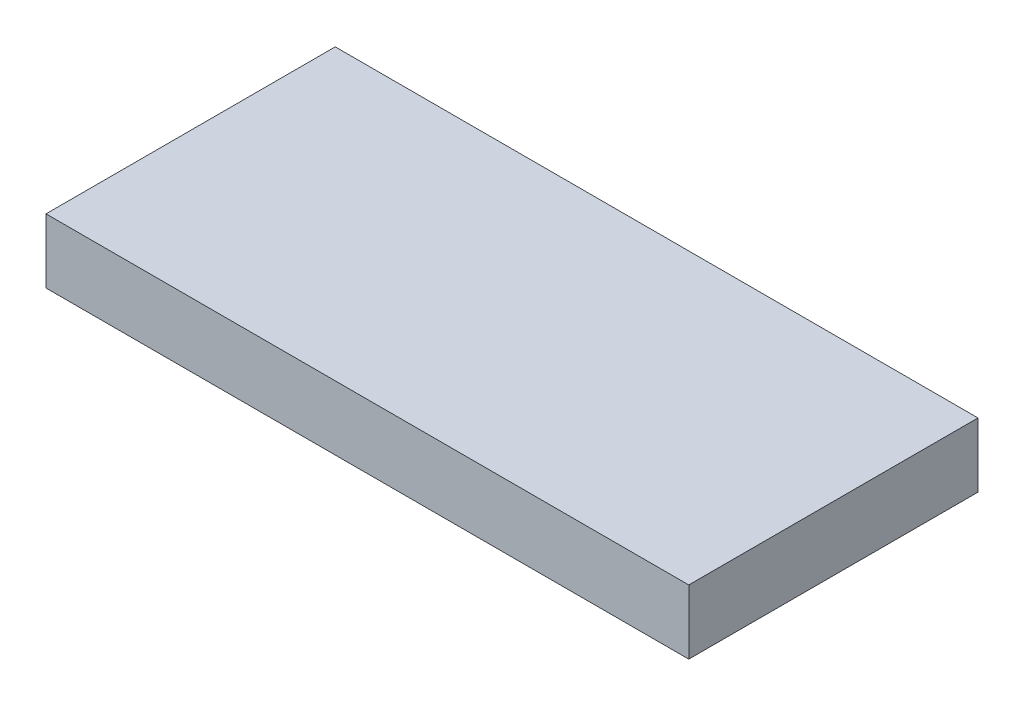
from build123d import *

# Parameters (mm, degrees)
SKETCH1_W           = 100
SKETCH1_H           = 45
BOSS_EXTRUDE1_DEPTH = 10


with BuildPart() as part:
    # Sketch1 → Boss-Extrude1 (new body)
    with BuildSketch(Plane(origin=(0, 0, 0), x_dir=(1, 0, 0), z_dir=(0, 1, 0))):
        Rectangle(SKETCH1_W, SKETCH1_H)
    extrude(amount=BOSS_EXTRUDE1_DEPTH)


solid = part.part
